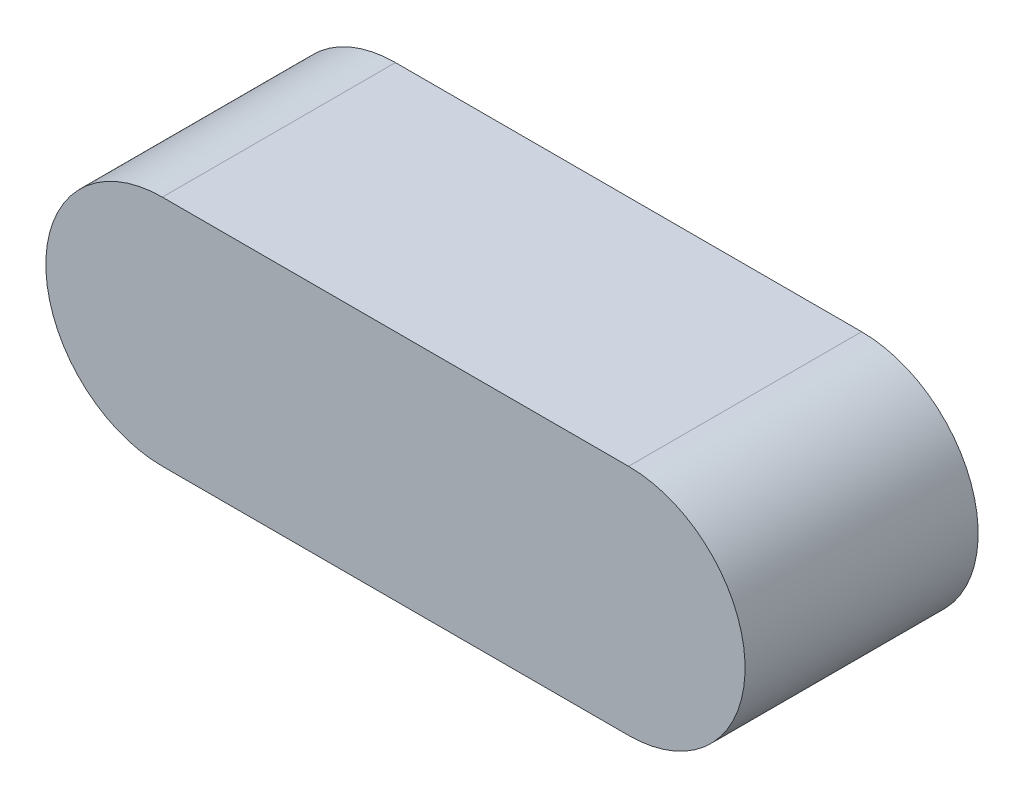
from build123d import *

# Parameters (mm, degrees)
BOSS_EXTRUDE1_DEPTH = 5


with BuildPart() as part:
    # Sketch1 → Boss-Extrude1 (new, symmetric)
    with BuildSketch(Plane.XY):
        with BuildLine():
            Line((5, -5), (25, -5))
            ThreePointArc((25, -5), (30, -10), (25, -15))
            Line((25, -15), (5, -15))
            ThreePointArc((5, -15), (0, -10), (5, -5))
        make_face()
    extrude(amount=BOSS_EXTRUDE1_DEPTH, both=True)


solid = part.part
